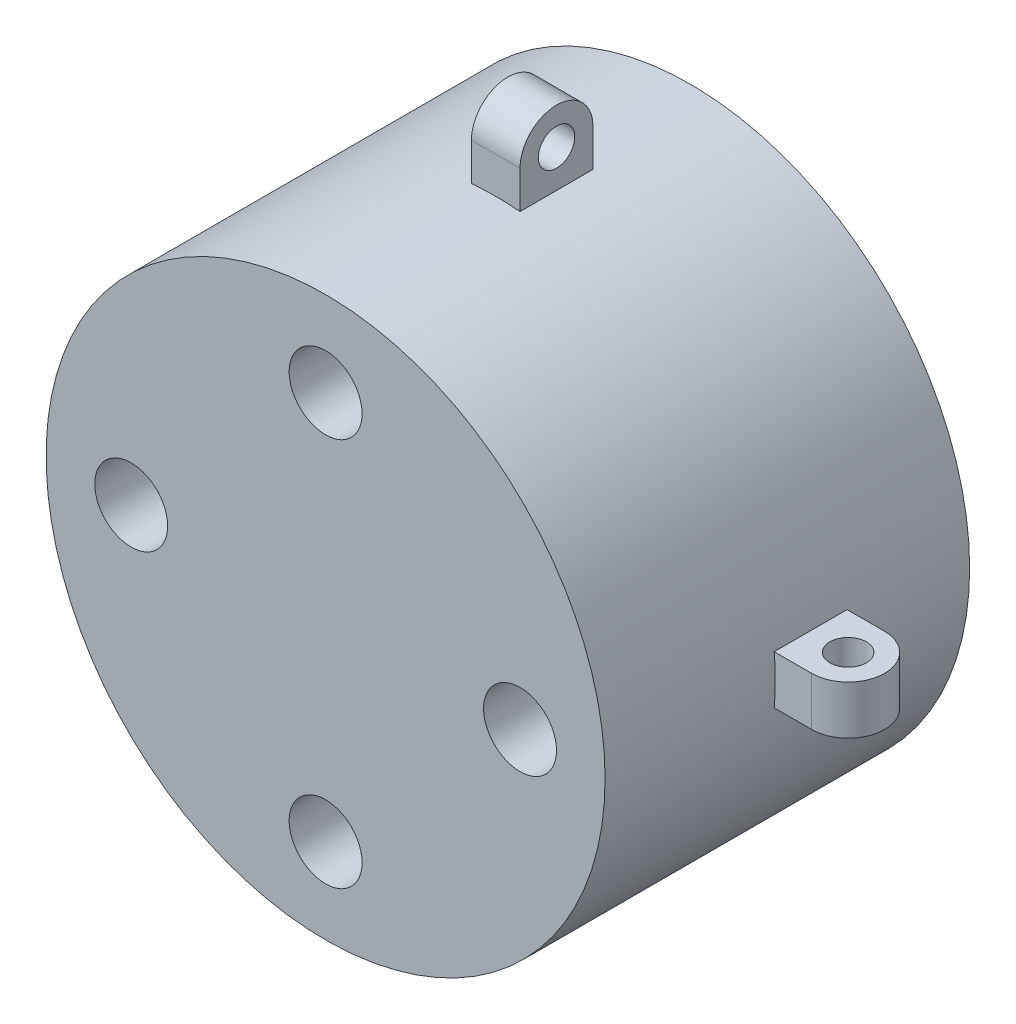
from build123d import *

# Parameters (mm, degrees)
SKETCH_1_R               = 23
EXTRUDE_1_DEPTH          = 30
SKETCH_2_R               = 3
CUT_EXTRUDE_1_DEPTH      = 45.24929378
EXTRUDE_2_DEPTH          = 2
SKETCH_4_R               = 1.5
CUT_EXTRUDE_2_DEPTH      = 49.641546028
PATTERN_CIRCULAR_2_COUNT = 4


with BuildPart() as part:
    # 草图1 → 凸台-拉伸1 (new body)
    with BuildSketch(Plane.XY):
        Circle(SKETCH_1_R)
    extrude(amount=EXTRUDE_1_DEPTH)

    # 草图2 → 切除-拉伸1 (cut, through all)
    with BuildSketch(Plane.XY.offset(30)):
        with Locations((16, 0)):
            Circle(SKETCH_2_R)
        with Locations((0, 16)):
            Circle(SKETCH_2_R)
        with Locations((-16, 0)):
            Circle(SKETCH_2_R)
        with Locations((0, -16)):
            Circle(SKETCH_2_R)
    extrude(amount=-CUT_EXTRUDE_1_DEPTH, mode=Mode.SUBTRACT)

    # 草图3 → 凸台-拉伸2 (add, symmetric)
    with BuildSketch(Plane(origin=(0, 0, 0), x_dir=(0, 0, -1), z_dir=(1, 0, 0))):
        with BuildLine():
            Line((-10, 22), (-16, 22))
            Line((-16, 22), (-16, 26))
            ThreePointArc((-16, 26), (-13, 29), (-10, 26))
            Line((-10, 26), (-10, 22))
        make_face()
    extrude_2 = extrude(amount=EXTRUDE_2_DEPTH, both=True)

    # 草图4 → 切除-拉伸2 (cut, through all)
    with BuildSketch(Plane(origin=(2, 0, 0), x_dir=(0, 0, -1), z_dir=(1, 0, 0))):
        with Locations((-13, 26)):
            Circle(SKETCH_4_R)
    cut_extrude_2 = extrude(amount=-CUT_EXTRUDE_2_DEPTH, mode=Mode.SUBTRACT)

    # 阵列(圆周)2: 凸台-拉伸2, 切除-拉伸2 ×4 about axis
    pattern_circular_2_axis = Axis((0, 0, 30), (0, 0, -1))
    add([extrude_2.rotate(pattern_circular_2_axis, i * 360 / PATTERN_CIRCULAR_2_COUNT) for i in range(1, PATTERN_CIRCULAR_2_COUNT)])
    add([cut_extrude_2.rotate(pattern_circular_2_axis, i * 360 / PATTERN_CIRCULAR_2_COUNT) for i in range(1, PATTERN_CIRCULAR_2_COUNT)], mode=Mode.SUBTRACT)


solid = part.part
